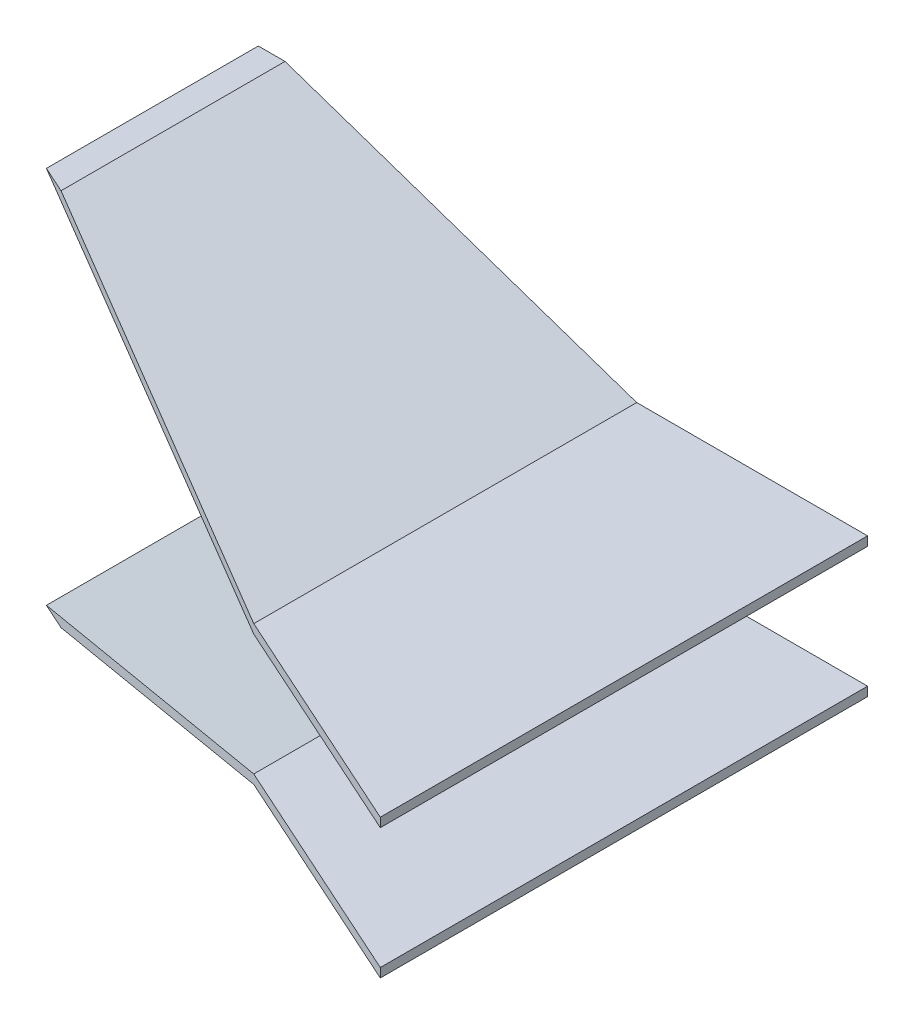
from build123d import *

# Parameters (mm, degrees)
ESBO_O1_W                = 6
ESBO_O1_H                = 250
RESSALTO_EXTRUS_O1_DEPTH = 140
RESSALTO_EXTRUS_O2_DEPTH = 250
CORTE_EXTRUS_O2_DEPTH    = 385.234303518
CORTE_EXTRUS_O3_DEPTH    = 385.234303518
RESSALTO_EXTRUS_O3_DEPTH = 140
ESBO_O7_W                = 140
ESBO_O7_H                = 250
CORTE_EXTRUS_O4_DEPTH    = 435.751653246
ESBO_O16_W               = 152.541281031
ESBO_O16_H               = 6
RESSALTO_EXTRUS_O7_DEPTH = 818
ESBO_O18_W               = 875.999462612
ESBO_O18_H               = 418.194526065
CORTE_EXTRUS_O7_DEPTH    = 878.372173794


with BuildPart() as part:
    # Esboço1 → Ressalto-extrusão1 (new body)
    with BuildSketch(Plane.XY):
        with Locations((3, -125)):
            Rectangle(ESBO_O1_W, ESBO_O1_H)
    extrude(amount=RESSALTO_EXTRUS_O1_DEPTH)

    # Esboço7 → Corte-extrusão4 (cut, through all)
    with BuildSketch(Plane(origin=(6, 0, 0), x_dir=(0, 0, -1), z_dir=(1, 0, 0))):
        with Locations((-70, -125)):
            Rectangle(ESBO_O7_W, ESBO_O7_H)
    extrude(amount=-CORTE_EXTRUS_O4_DEPTH, mode=Mode.SUBTRACT)


with BuildPart() as body_2:
    # Esboço3 → Ressalto-extrusão2 (new body)
    with BuildSketch(Plane(origin=(0, 0, 0), x_dir=(1, 0, 0), z_dir=(0, 1, 0))):
        Polygon((6, -140), (256, -253), (256, -140), align=None)
    extrude(amount=-RESSALTO_EXTRUS_O2_DEPTH)

    # Esboço5 → Corte-extrusão2 (cut, through all)
    with BuildSketch(Plane(origin=(0, 0, 140), x_dir=(-1, 0, 0), z_dir=(0, 0, -1))):
        Polygon((-256, -85), (-6, 0), (-6, -250), (-256, -165), align=None)
    extrude(amount=-CORTE_EXTRUS_O2_DEPTH, mode=Mode.SUBTRACT)


with BuildPart() as corte_extrus_o2_piece_1:
    # of the separate pieces the step leaves, piece 1, a body of its own (corte_extrus_o2_pieces)
    add(body_2.part.solids().sort_by_distance((256, -165, 253))[0])


with BuildPart() as corte_extrus_o2_piece_2:
    # of the separate pieces the step leaves, piece 2, a body of its own (corte_extrus_o2_pieces)
    add(body_2.part.solids().sort_by_distance((6, 0, 140))[0])


with BuildPart() as corte_extrus_o3_tool:
    # Esboço6 → Corte-extrusão3 (new, through all)
    with BuildSketch(Plane(origin=(0, 0, 140), x_dir=(-1, 0, 0), z_dir=(0, 0, -1))):
        Polygon((-23.647058824, 0), (-256, 0), (-256, -79), align=None)
        Polygon((-23.647058824, -250), (-256, -171), (-256, -250), align=None)
    extrude(amount=-CORTE_EXTRUS_O3_DEPTH)


with BuildPart() as corte_extrus_o2_piece_1_1:
    add(corte_extrus_o2_piece_1.part)

    # Corte-extrusão3: cut by corte_extrus_o3_tool
    add(corte_extrus_o3_tool.part, mode=Mode.SUBTRACT)


with BuildPart() as corte_extrus_o2_piece_2_1:
    add(corte_extrus_o2_piece_2.part)

    # Corte-extrusão3: cut by corte_extrus_o3_tool
    add(corte_extrus_o3_tool.part, mode=Mode.SUBTRACT)


    add(corte_extrus_o2_piece_1_1.part)  # Ressalto-extrusão3 merges Corte-extrusão2 piece 1
    # Esboço8 → Ressalto-extrusão3 (add)
    with BuildSketch(Plane(origin=(0, 0, 140), x_dir=(-1, 0, 0), z_dir=(0, 0, -1))):
        Polygon((-256, -79), (-23.647058824, 0), (-6, 0), (-256, -85), align=None)
        Polygon((-256, -165), (-256, -171), (-23.647058824, -250), (-6, -250), align=None)
    extrude(amount=RESSALTO_EXTRUS_O3_DEPTH)

    # Esboço16 → Ressalto-extrusão7 (add)
    with BuildSketch(Plane(origin=(0, 0, 0), x_dir=(-1, 0, 0), z_dir=(0, 0, -1))):
        with Locations((-332.270640516, -82)):
            Rectangle(ESBO_O16_W, ESBO_O16_H)
        with Locations((-332.270640516, -168)):
            Rectangle(ESBO_O16_W, ESBO_O16_H)
    extrude(amount=-RESSALTO_EXTRUS_O7_DEPTH)

    # Esboço18 → Corte-extrusão7 (cut, through all)
    with BuildSketch(Plane(origin=(-51.527003149, 0, 113.997794577), x_dir=(0.9112382379380309, 0, 0.41187968354799004), z_dir=(-0.41187968354799004, 0, 0.9112382379380309))):
        with Locations((331.831279582, -101.987624117)):
            Rectangle(ESBO_O18_W, ESBO_O18_H)
    extrude(amount=CORTE_EXTRUS_O7_DEPTH, mode=Mode.SUBTRACT)


solid = corte_extrus_o2_piece_2_1.part
